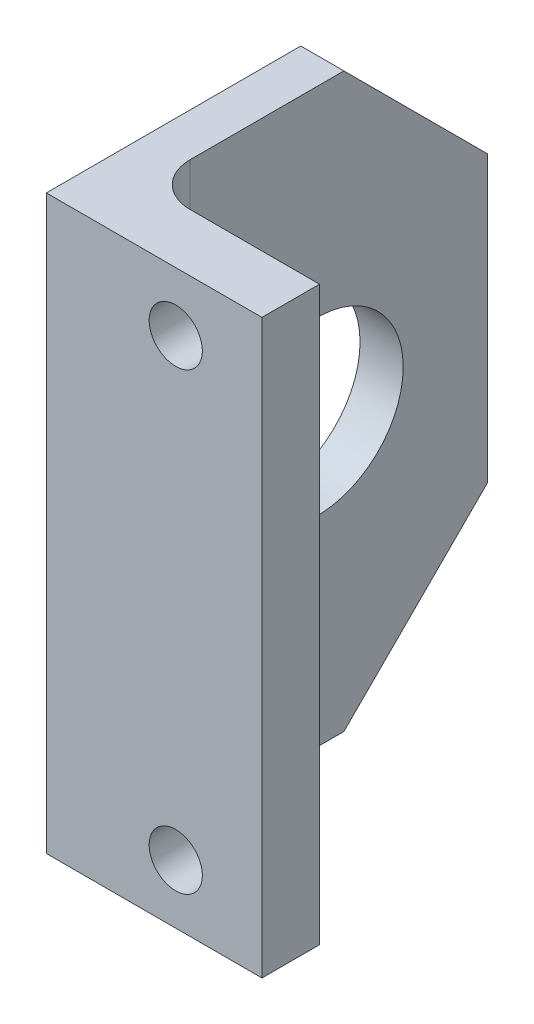
from build123d import *

# Parameters (mm, degrees)
BOSS_EXTRUDE1_DEPTH = 39.8
SKETCH2_R           = 1.85
CUT_EXTRUDE1_DEPTH  = 39.8
SKETCH3_R           = 5.975
CUT_EXTRUDE2_DEPTH  = 39.8
CHAMFER1_SIZE       = 10
FILLET1_R           = 3


with BuildPart() as part:
    # Sketch1 → Boss-Extrude1 (new body)
    with BuildSketch(Plane(origin=(0, 0, 0), x_dir=(1, 0, 0), z_dir=(0, 1, 0))):
        Polygon((0, 0), (0, 27.7), (3, 27.7), (3, 4), (15, 4), (15, 0), align=None)
    extrude(amount=BOSS_EXTRUDE1_DEPTH)

    # Sketch2 → Cut-Extrude1 (cut)
    with BuildSketch(Plane(origin=(0, 0, -4), x_dir=(-1, 0, 0), z_dir=(0, 0, -1))):
        with Locations((-9, 35.7)):
            Circle(SKETCH2_R)
        with Locations((-9, 4.1)):
            Circle(SKETCH2_R)
    extrude(amount=-CUT_EXTRUDE1_DEPTH, mode=Mode.SUBTRACT)

    # Sketch3 → Cut-Extrude2 (cut)
    with BuildSketch(Plane(origin=(3, 0, 0), x_dir=(0, 0, -1), z_dir=(1, 0, 0))):
        with Locations((15.85, 19.9)):
            Circle(SKETCH3_R)
    extrude(amount=-CUT_EXTRUDE2_DEPTH, mode=Mode.SUBTRACT)

    # Chamfer1
    chamfer1_edges = [part.edges().sort_by_distance(p)[0] for p in [
        (1.5, 39.8, -27.7),
        (1.5, 0, -27.7),
    ]]
    chamfer(chamfer1_edges, length=CHAMFER1_SIZE)

    # Fillet1
    fillet1_edges = [part.edges().sort_by_distance(p)[0] for p in [
        (3, 19.9, -4),
    ]]
    fillet(fillet1_edges, radius=FILLET1_R)


solid = part.part
